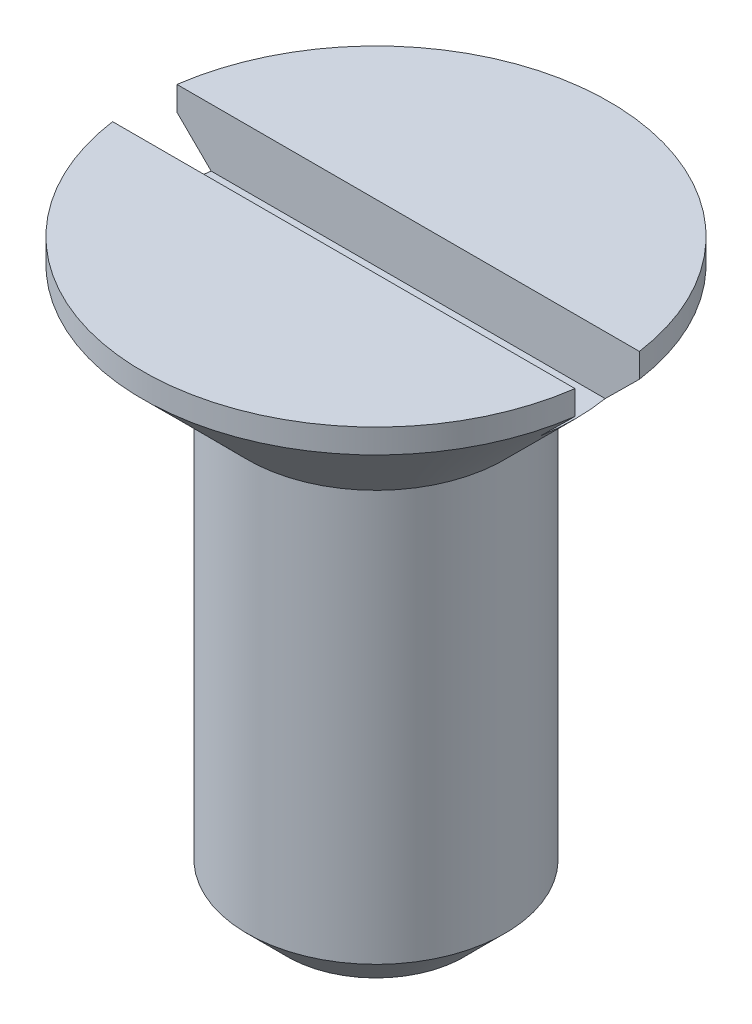
from build123d import *

# Parameters (mm, degrees)
SKETCH_13_W         = 14.5
SKETCH_13_H         = 2
CUT_EXTRUDE_9_DEPTH = 1.8
CHAMFER_1_SIZE      = 1.25


with BuildPart() as part:
    # Эскиз1 → Повернуть1 (revolve)
    with BuildSketch(Plane.XY):
        Polygon((0, 92.035042223), (0, 74.035042223), (4, 74.035042223), (4, 88.035042223), (7.25, 91.285042223), (7.25, 92.035042223), align=None)
    revolve(axis=Axis((0, 125.763182898, 0), (0, -1, 0)))

    # Эскиз13 → Вырез-Вытянуть9 (cut)
    with BuildSketch(Plane(origin=(0, 92.035042223, 0), x_dir=(-1, 0, 0), z_dir=(0, 1, 0))):
        Rectangle(SKETCH_13_W, SKETCH_13_H)
    extrude(amount=-CUT_EXTRUDE_9_DEPTH, mode=Mode.SUBTRACT)

    # Фаска1
    chamfer_1_edges = [part.edges().sort_by_distance(p)[0] for p in [
        (-4, 74.035042223, 0),
    ]]
    chamfer(chamfer_1_edges, length=CHAMFER_1_SIZE)


solid = part.part
